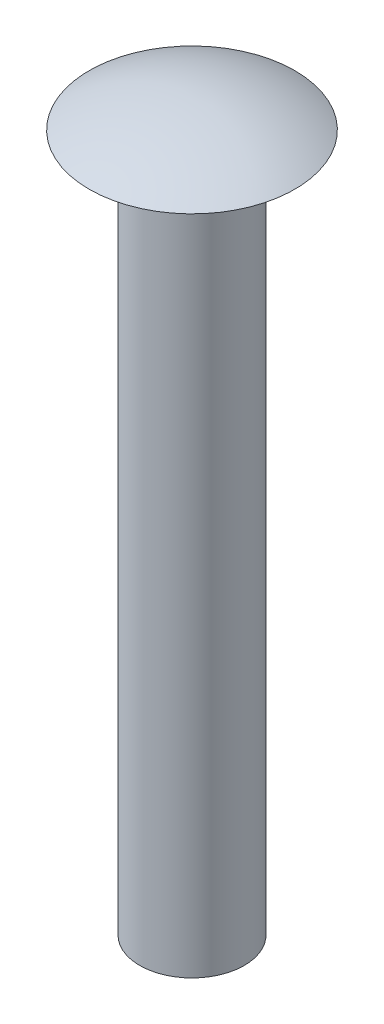
from build123d import *


with BuildPart() as part:
    # Sketch1 → Revolve1 (revolve)
    with BuildSketch(Plane(origin=(0, 0, 0), x_dir=(0, 0, -1), z_dir=(1, 0, 0))):
        with BuildLine():
            Line((0, 7.173295455), (0, -2.826704545))
            Line((0, -2.826704545), (-0.75, -2.826704545))
            Line((-0.75, -2.826704545), (-0.75, 7.560533622))
            ThreePointArc((-0.75, 7.560533622), (0.012139916, 7.46210953), (0.724271212, 7.173295455))
            Line((0.724271212, 7.173295455), (0, 7.173295455))
        make_face()
    revolve(axis=Axis((0, -2.826704545, 0.75), (0, 1, 0)))


solid = part.part
